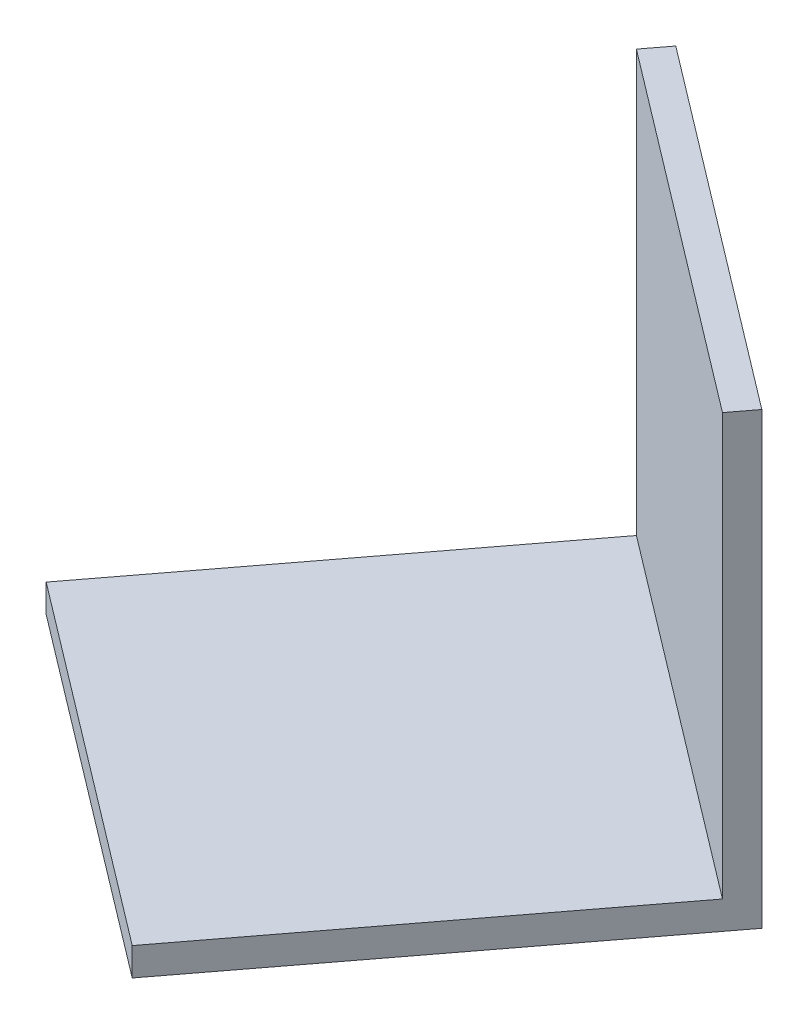
from build123d import *

# Parameters (mm, degrees)
BOSS_EXTRUDE1_DEPTH = 1.5875
BOSS_EXTRUDE2_DEPTH = 23.8125


with BuildPart() as part:
    # Sketch1 → Boss-Extrude1 (new body)
    with BuildSketch(Plane(origin=(0, 0, 0), x_dir=(1, 0, 0), z_dir=(0, 1, 0))):
        Polygon((0, 0), (15.362627366, 20.227448688), (-4.864821322, 35.590076054), (-20.227448688, 15.362627366), align=None)
    extrude(amount=BOSS_EXTRUDE1_DEPTH)

    # Sketch2 → Boss-Extrude2 (add)
    with BuildSketch(Plane(origin=(0, 1.5875, 0), x_dir=(1, 0, 0), z_dir=(0, 1, 0))):
        Polygon((-4.864821322, 35.590076054), (-5.824985532, 34.325860511), (14.402463156, 18.963233145), (15.362627366, 20.227448688), align=None)
    extrude(amount=BOSS_EXTRUDE2_DEPTH)


solid = part.part
